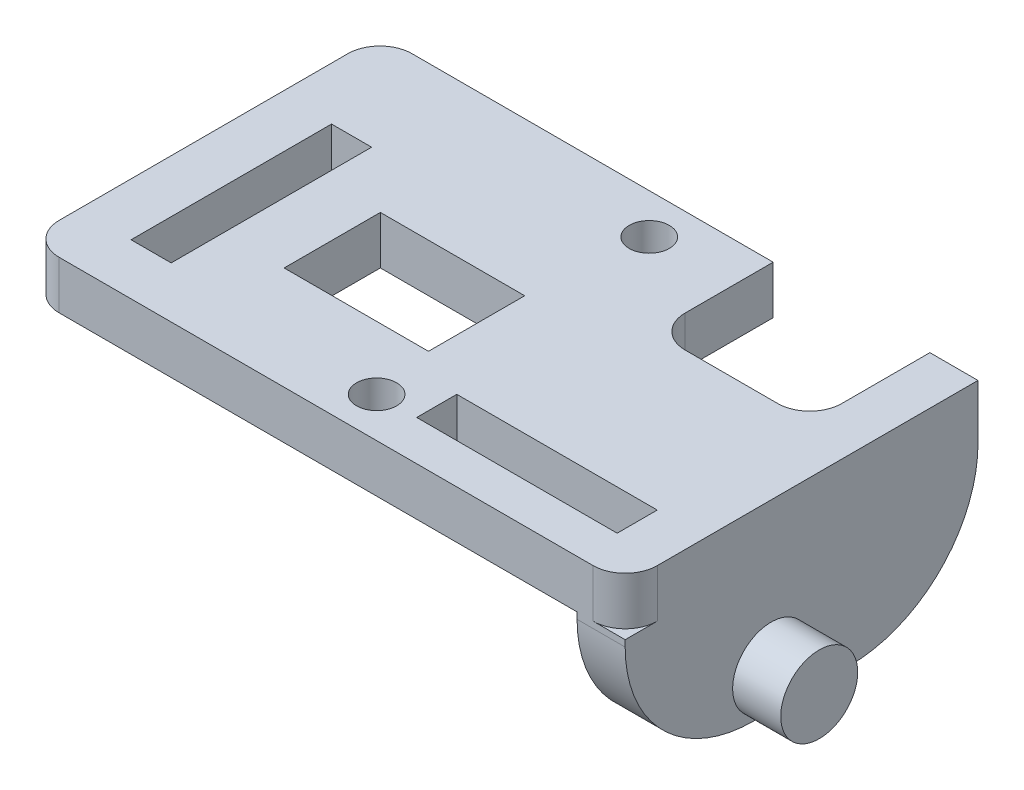
from build123d import *

# Parameters (mm, degrees)
SKETCH1_W           = 12.5
SKETCH1_H           = 2.5
SKETCH1_W_2         = 2.5
SKETCH1_H_2         = 12.5
SKETCH1_W_3         = 9
SKETCH1_H_3         = 6
BOSS_EXTRUDE1_DEPTH = 3
FILLET1_R           = 2
SKETCH1_4_W         = 3
SKETCH1_4_H         = 22
BOSS_EXTRUDE2_DEPTH = 8.4
SKETCH2_R           = 2.4
BOSS_EXTRUDE3_DEPTH = 3
FILLET2_R           = 8
SKETCH1_7_R         = 1.25
CUT_EXTRUDE2_DEPTH  = 53.505324486


with BuildPart() as part:
    # Sketch1 → Boss-Extrude1 (new body)
    with BuildSketch(Plane(origin=(0, 0, 0), x_dir=(1, 0, 0), z_dir=(0, 1, 0))):
        Polygon((-38.561763486, -34.630037485), (-1.270220731, -34.630037485), (-1.270220731, -12.630037485), (-4.270220731, -12.630037485), (-4.270220731, -20.12144272), (-14.041444449, -20.12144272), (-14.041444449, -12.630037485), (-38.561763486, -12.630037485), align=None)
        with Locations((-10.520220731, -30.880037485)):
            Rectangle(SKETCH1_W, SKETCH1_H, mode=Mode.SUBTRACT)
        with Locations((-34.020220731, -25.190037485)):
            Rectangle(SKETCH1_W_2, SKETCH1_H_2, mode=Mode.SUBTRACT)
        with Locations((-24.475907507, -25.190037485)):
            Rectangle(SKETCH1_W_3, SKETCH1_H_3, mode=Mode.SUBTRACT)
    extrude(amount=BOSS_EXTRUDE1_DEPTH)

    # Fillet1
    fillet1_edges = [part.edges().sort_by_distance(p)[0] for p in [
        (-38.561763486, 1.5, 12.630037485),
        (-38.561763486, 1.5, 34.630037485),
        (-1.270220731, 1.5, 34.630037485),
        (-14.041444449, 1.5, 20.12144272),
        (-4.270220731, 1.5, 20.12144272),
    ]]
    fillet(fillet1_edges, radius=FILLET1_R)

    # Sketch1<4> → Boss-Extrude2 (add)
    with BuildSketch(Plane(origin=(0, 0, 0), x_dir=(1, 0, 0), z_dir=(0, 1, 0))):
        with Locations((-2.770220731, -23.630037485)):
            Rectangle(SKETCH1_4_W, SKETCH1_4_H)
    extrude(amount=-BOSS_EXTRUDE2_DEPTH)

    # Sketch2 → Boss-Extrude3 (add)
    with BuildSketch(Plane(origin=(-1.270220731, 0, 0), x_dir=(0, 0, -1), z_dir=(1, 0, 0))):
        with Locations((-25.530037485, -6)):
            Circle(SKETCH2_R)
    extrude(amount=BOSS_EXTRUDE3_DEPTH)

    # Fillet2
    fillet2_edges = [part.edges().sort_by_distance(p)[0] for p in [
        (-2.770220731, -8.4, 12.630037485),
        (-2.770220731, -8.4, 34.630037485),
    ]]
    fillet(fillet2_edges, radius=FILLET2_R)

    # Sketch1<7> → Cut-Extrude2 (cut, through all)
    with BuildSketch(Plane(origin=(0, 0, 0), x_dir=(1, 0, 0), z_dir=(0, 1, 0))):
        with Locations((-19.270220731, -32.130037485)):
            Circle(SKETCH1_7_R)
        with Locations((-19.270220731, -15.130037485)):
            Circle(SKETCH1_7_R)
    extrude(amount=CUT_EXTRUDE2_DEPTH, mode=Mode.SUBTRACT)


solid = part.part
